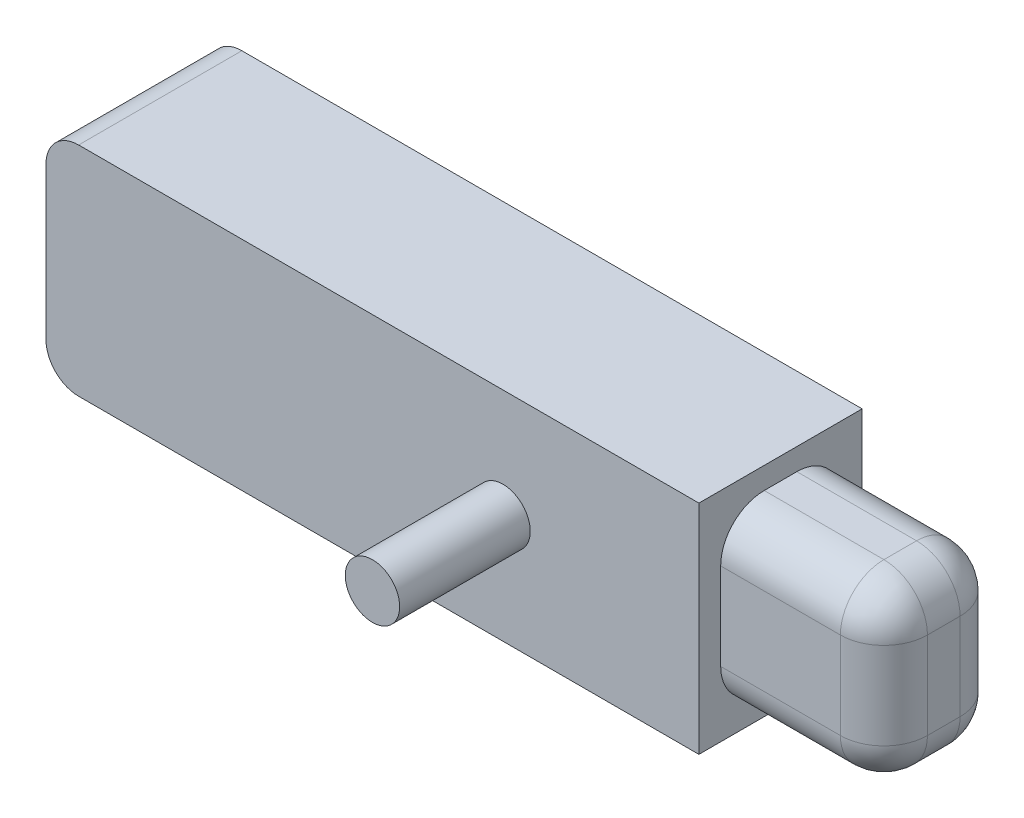
from build123d import *

# Parameters (mm, degrees)
SKETCH1_W           = 60
SKETCH1_H           = 15
BOSS_EXTRUDE1_DEPTH = 20
SKETCH2_R           = 2.5
BOSS_EXTRUDE2_DEPTH = 12
SKETCH3_W           = 11
SKETCH3_H           = 16
BOSS_EXTRUDE3_DEPTH = 15
FILLET1_R           = 4
FILLET2_R           = 4
FILLET3_R           = 3


with BuildPart() as part:
    # Sketch1 → Boss-Extrude1 (new body)
    with BuildSketch(Plane(origin=(0, 0, 0), x_dir=(1, 0, 0), z_dir=(0, 1, 0))):
        Rectangle(SKETCH1_W, SKETCH1_H)
    extrude(amount=BOSS_EXTRUDE1_DEPTH)

    # Sketch2 → Boss-Extrude2 (add)
    with BuildSketch(Plane.XY.offset(7.5)):
        with Locations(Location((12, 10, 0), (0, 0, 180))):
            Circle(SKETCH2_R)
    extrude(amount=BOSS_EXTRUDE2_DEPTH)

    # Sketch3 → Boss-Extrude3 (add)
    with BuildSketch(Plane(origin=(30, 0, 0), x_dir=(0, 0, -1), z_dir=(1, 0, 0))):
        with Locations((0, 10)):
            Rectangle(SKETCH3_W, SKETCH3_H)
    extrude(amount=BOSS_EXTRUDE3_DEPTH)

    # Fillet1
    fillet1_edges = [part.edges().sort_by_distance(p)[0] for p in [
        (37.5, 18, 5.5),
        (37.5, 2, 5.5),
        (37.5, 2, -5.5),
        (37.5, 18, -5.5),
    ]]
    fillet(fillet1_edges, radius=FILLET1_R)

    # Fillet2
    fillet2_edges = [part.edges().sort_by_distance(p)[0] for p in [
        (45, 10, 5.5),
        (45, 18, 0),
        (45, 2, 0),
        (45, 10, -5.5),
        (45, 3.171572875, 4.328427125),
        (45, 3.171572875, -4.328427125),
        (45, 16.828427125, -4.328427125),
        (45, 16.828427125, 4.328427125),
    ]]
    fillet(fillet2_edges, radius=FILLET2_R)

    # Fillet3
    fillet3_edges = [part.edges().sort_by_distance(p)[0] for p in [
        (-30, 20, 0),
        (-30, 0, 0),
    ]]
    fillet(fillet3_edges, radius=FILLET3_R)


solid = part.part
